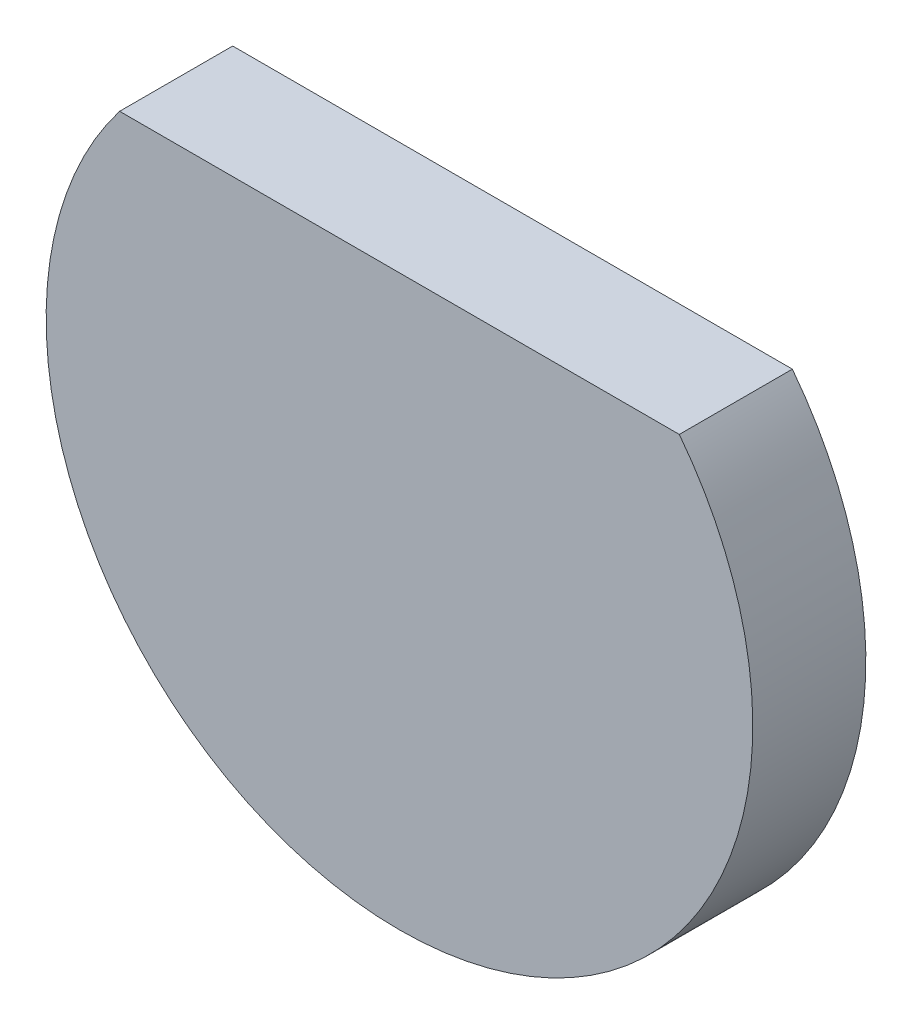
from build123d import *

# Parameters (mm, degrees)
BOSS_EXTRUDE1_DEPTH = 20


with BuildPart() as part:
    # Sketch1 → Boss-Extrude1 (new body)
    with BuildSketch(Plane.XY):
        with BuildLine():
            Line((-49.5, 38.157568057), (49.5, 38.157568057))
            ThreePointArc((49.5, 38.157568057), (0, -62.5), (-49.5, 38.157568057))
        make_face()
    extrude(amount=BOSS_EXTRUDE1_DEPTH)


solid = part.part
